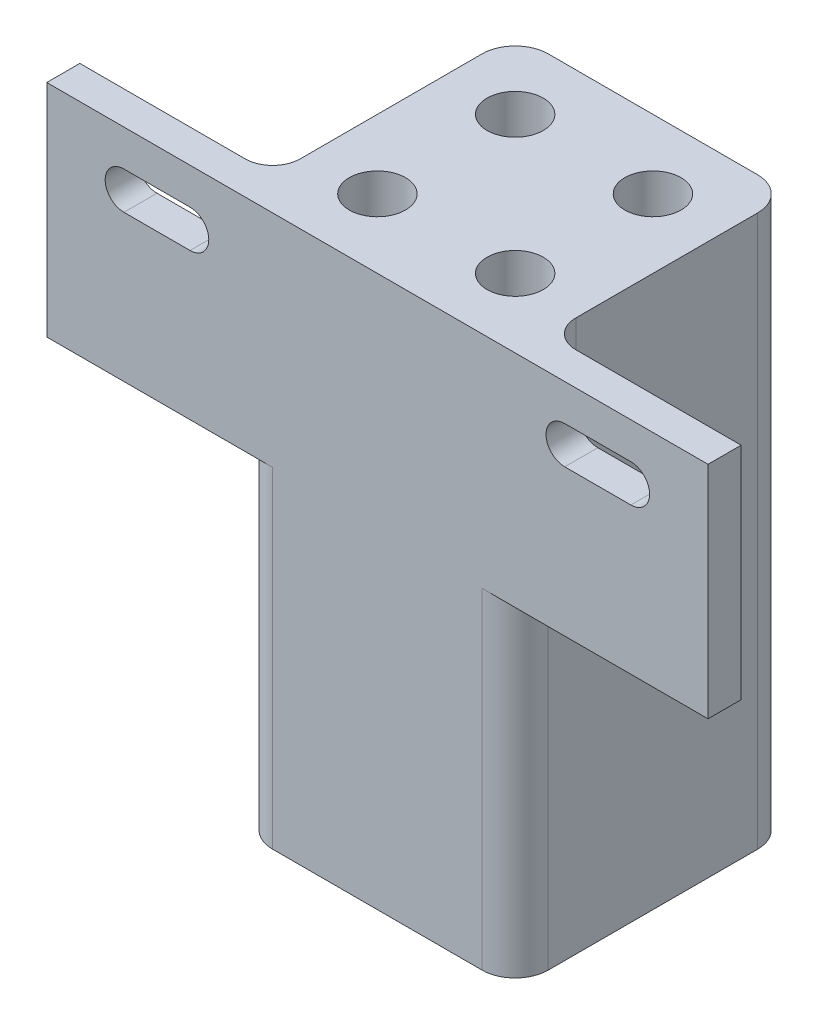
from build123d import *

# Parameters (mm, degrees)
SKETCH_1_R          = 2.55
EXTRUDE_1_DEPTH     = 30
SKETCH_2_R          = 2.55
EXTRUDE_2_DEPTH     = 20
CUT_EXTRUDE_1_DEPTH = 20
FILLET_1_R          = 2.5


with BuildPart() as part:
    # 草图1 → 凸台-拉伸1 (new body)
    with BuildSketch(Plane(origin=(0, 0, 0), x_dir=(1, 0, 0), z_dir=(0, 1, 0))):
        with BuildLine():
            Line((-9.5, 12.5), (9.5, 12.5))
            ThreePointArc((9.5, 12.5), (11.621320344, 11.621320344), (12.5, 9.5))
            Line((12.5, 9.5), (12.5, -9.5))
            ThreePointArc((12.5, -9.5), (11.621320344, -11.621320344), (9.5, -12.5))
            Line((9.5, -12.5), (-9.5, -12.5))
            ThreePointArc((-9.5, -12.5), (-11.621320344, -11.621320344), (-12.5, -9.5))
            Line((-12.5, -9.5), (-12.5, 9.5))
            ThreePointArc((-12.5, 9.5), (-11.621320344, 11.621320344), (-9.5, 12.5))
        make_face()
        with Locations(Location((6.25, 6.25, 0), (0, 0, 270))):
            Circle(SKETCH_1_R, mode=Mode.SUBTRACT)
        with Locations(Location((-6.25, 6.25, 0), (0, 0, 270))):
            Circle(SKETCH_1_R, mode=Mode.SUBTRACT)
        with Locations(Location((-6.25, -6.25, 0), (0, 0, 270))):
            Circle(SKETCH_1_R, mode=Mode.SUBTRACT)
        with Locations(Location((6.25, -6.25, 0), (0, 0, 270))):
            Circle(SKETCH_1_R, mode=Mode.SUBTRACT)
    extrude(amount=EXTRUDE_1_DEPTH)

    # 草图2 → 凸台-拉伸2 (add)
    with BuildSketch(Plane(origin=(0, 30, 0), x_dir=(1, 0, 0), z_dir=(0, 1, 0))):
        with BuildLine():
            Line((-9.5, -12.5), (-30, -12.5))
            Line((-30, -12.5), (-30, -9.5))
            Line((-30, -9.5), (-12.5, -9.5))
            Line((-12.5, -9.5), (-12.5, 9.5))
            ThreePointArc((-12.5, 9.5), (-11.621320344, 11.621320344), (-9.5, 12.5))
            Line((-9.5, 12.5), (9.5, 12.5))
            ThreePointArc((9.5, 12.5), (11.621320344, 11.621320344), (12.5, 9.5))
            Line((12.5, 9.5), (12.5, -9.5))
            Line((12.5, -9.5), (30, -9.5))
            Line((30, -9.5), (30, -12.5))
            Line((30, -12.5), (9.5, -12.5))
            Line((9.5, -12.5), (-9.5, -12.5))
        make_face()
        with Locations(Location((-6.25, 6.25, 0), (0, 0, 270))):
            Circle(SKETCH_2_R, mode=Mode.SUBTRACT)
        with Locations(Location((6.25, 6.25, 0), (0, 0, 270))):
            Circle(SKETCH_2_R, mode=Mode.SUBTRACT)
        with Locations(Location((-6.25, -6.25, 0), (0, 0, 270))):
            Circle(SKETCH_2_R, mode=Mode.SUBTRACT)
        with Locations(Location((6.25, -6.25, 0), (0, 0, 270))):
            Circle(SKETCH_2_R, mode=Mode.SUBTRACT)
    extrude(amount=EXTRUDE_2_DEPTH)

    # 草图3 → 切除-拉伸1 (cut)
    with BuildSketch(Plane(origin=(0, 0, 9.5), x_dir=(-1, 0, 0), z_dir=(0, 0, -1))):
        with BuildLine():
            Line((-23, 46.7), (-17, 46.7))
            ThreePointArc((-17, 46.7), (-15.3, 45), (-17, 43.3))
            Line((-17, 43.3), (-23, 43.3))
            ThreePointArc((-23, 43.3), (-24.7, 45), (-23, 46.7))
        make_face()
        with BuildLine():
            Line((23, 43.3), (17, 43.3))
            ThreePointArc((17, 43.3), (15.3, 45), (17, 46.7))
            Line((17, 46.7), (23, 46.7))
            ThreePointArc((23, 46.7), (24.7, 45), (23, 43.3))
        make_face()
    extrude(amount=-CUT_EXTRUDE_1_DEPTH, mode=Mode.SUBTRACT)

    # 圆角1
    fillet_1_edges = [part.edges().sort_by_distance(p)[0] for p in [
        (12.5, 40, 9.5),
        (-12.5, 40, 9.5),
    ]]
    fillet(fillet_1_edges, radius=FILLET_1_R)


solid = part.part
